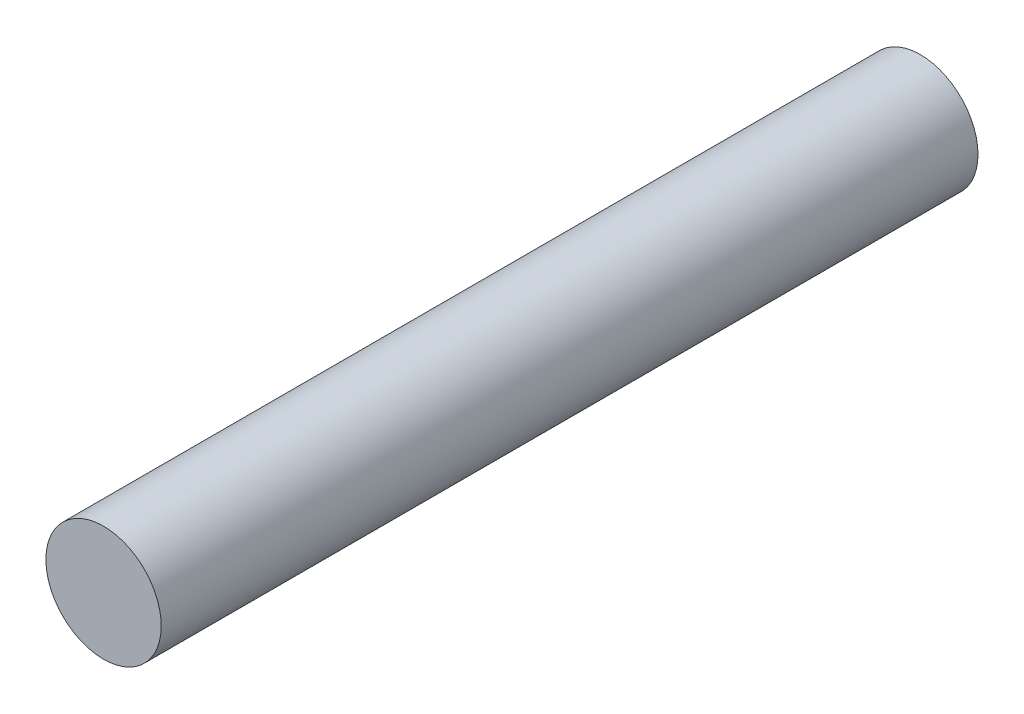
from build123d import *

# Parameters (mm, degrees)
SKETCH1_R           = 6
BOSS_EXTRUDE1_DEPTH = 85


with BuildPart() as part:
    # Sketch1 → Boss-Extrude1 (new body)
    with BuildSketch(Plane.XY):
        Circle(SKETCH1_R)
    extrude(amount=BOSS_EXTRUDE1_DEPTH)


solid = part.part
